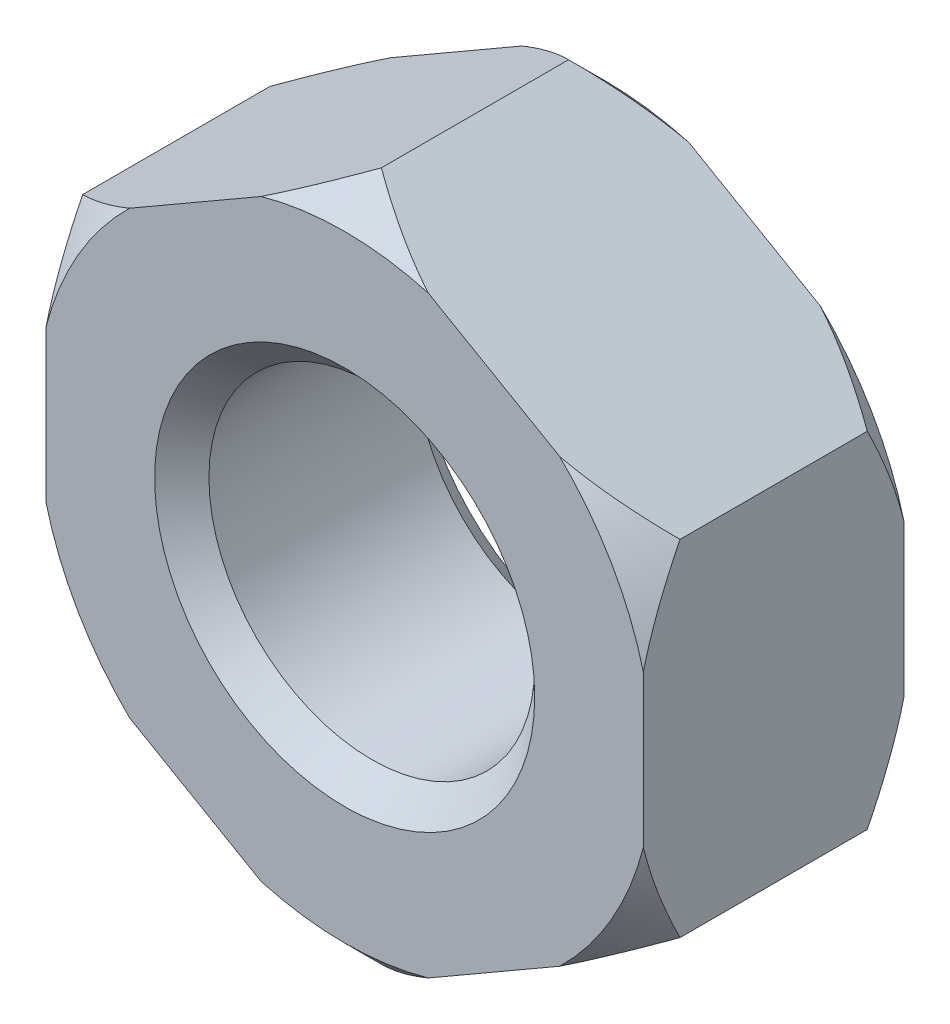
from build123d import *

# Parameters (mm, degrees)
EXTRUDE_1_DEPTH     = 2.4
SKETCH_2_R          = 1.5
CUT_EXTRUDE_1_DEPTH = 5.837957558
CHAMFER_1_SIZE      = 0.25


with BuildPart() as part:
    # Эскиз1 → Вытянуть1 (new body)
    with BuildSketch(Plane.XY):
        Polygon((0, 3.175426481), (-2.75, 1.58771324), (-2.75, -1.58771324), (0, -3.175426481), (2.75, -1.58771324), (2.75, 1.58771324), align=None)
    extrude(amount=EXTRUDE_1_DEPTH)

    # Эскиз15 → Вырез-Повернуть1 (revolve, cut)
    with BuildSketch(Plane(origin=(0, 0, 0), x_dir=(0, 0, -1), z_dir=(1, 0, 0))):
        Polygon((-2.4, 3.175426481), (-2.4, 2.837426481), (-2.062, 3.175426481), align=None)
        Polygon((-0.338, 3.175426481), (0, 3.175426481), (0, 2.837426481), align=None)
    revolve(axis=Axis((0, 0, 2.633835381), (0, 0, -1)), mode=Mode.SUBTRACT)

    # Эскиз2 → Вырез-Вытянуть1 (cut, through all)
    with BuildSketch(Plane(origin=(0, 0, 0), x_dir=(-1, 0, 0), z_dir=(0, 0, -1))):
        Circle(SKETCH_2_R)
    extrude(amount=-CUT_EXTRUDE_1_DEPTH, mode=Mode.SUBTRACT)

    # Фаска1
    chamfer_1_edges = [part.edges().sort_by_distance(p)[0] for p in [
        (1.5, 0, 2.4),
        (1.5, 0, 0),
    ]]
    chamfer(chamfer_1_edges, length=CHAMFER_1_SIZE)


solid = part.part
